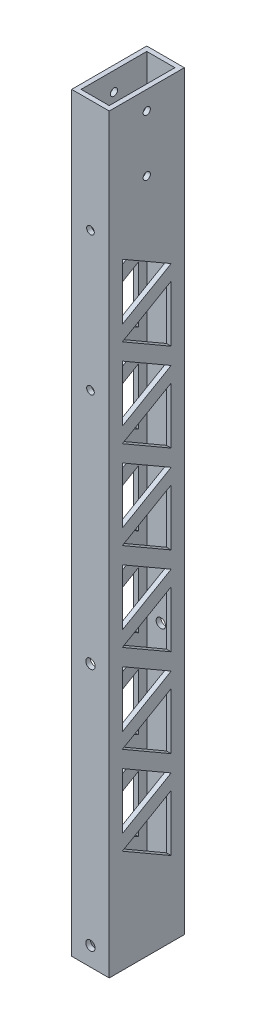
from build123d import *

# Parameters (mm, degrees)
SKETCH1_W           = 25.4
SKETCH1_H           = 50.8
SKETCH1_W_2         = 19.05
SKETCH1_H_2         = 44.45
BOSS_EXTRUDE1_DEPTH = 508
SKETCH3_R           = 3.175
CUT_EXTRUDE1_DEPTH  = 512.165139656
SKETCH4_R           = 2.4638
CUT_EXTRUDE2_DEPTH  = 512.165139656
CUT_EXTRUDE3_DEPTH  = 512.165139656
LPATTERN1_COUNT     = 6
LPATTERN1_PITCH     = 59.69
SKETCH6_R           = 2.5796875
CUT_EXTRUDE4_DEPTH  = 512.165139656


with BuildPart() as part:
    # Sketch1 → Boss-Extrude1 (new body)
    with BuildSketch(Plane(origin=(0, 0, 0), x_dir=(1, 0, 0), z_dir=(0, 1, 0))):
        with Locations((12.7, 25.4)):
            Rectangle(SKETCH1_W, SKETCH1_H)
        with Locations((12.7, 25.4)):
            Rectangle(SKETCH1_W_2, SKETCH1_H_2, mode=Mode.SUBTRACT)
    extrude(amount=BOSS_EXTRUDE1_DEPTH)

    # Sketch3 → Cut-Extrude1 (cut, through all)
    with BuildSketch(Plane.XY):
        with Locations((12.7, 177.8)):
            Circle(SKETCH3_R)
        with Locations((12.7, 12.7)):
            Circle(SKETCH3_R)
    extrude(amount=-CUT_EXTRUDE1_DEPTH, mode=Mode.SUBTRACT)

    # Sketch4 → Cut-Extrude2 (cut, through all)
    with BuildSketch(Plane.ZY):
        with Locations((-25.4, 457.2)):
            Circle(SKETCH4_R)
        with Locations((-25.4, 495.3)):
            Circle(SKETCH4_R)
    extrude(amount=-CUT_EXTRUDE2_DEPTH, mode=Mode.SUBTRACT)

    # Sketch5 → Cut-Extrude3 (cut, through all)
    with BuildSketch(Plane(origin=(25.4, 0, 0), x_dir=(0, 0, -1), z_dir=(1, 0, 0))):
        Polygon((41.91, 88.928211777), (8.89, 69.864105889), (41.91, 50.8), align=None)
        Polygon((41.91, 99.193499563), (8.89, 118.257605452), (8.89, 80.129393675), align=None)
    cut_extrude3 = extrude(amount=-CUT_EXTRUDE3_DEPTH, mode=Mode.SUBTRACT)

    # LPattern1: Cut-Extrude3 ×6
    with Locations(*[(0, i * LPATTERN1_PITCH, 0) for i in range(1, LPATTERN1_COUNT)]):
        add(cut_extrude3, mode=Mode.SUBTRACT)

    # Sketch6 → Cut-Extrude4 (cut, through all)
    with BuildSketch(Plane(origin=(0, 0, -50.8), x_dir=(-1, 0, 0), z_dir=(0, 0, -1))):
        with Locations((-12.7, 431.8)):
            Circle(SKETCH6_R)
        with Locations((-12.7, 338.053316528)):
            Circle(SKETCH6_R)
    extrude(amount=-CUT_EXTRUDE4_DEPTH, mode=Mode.SUBTRACT)


solid = part.part
